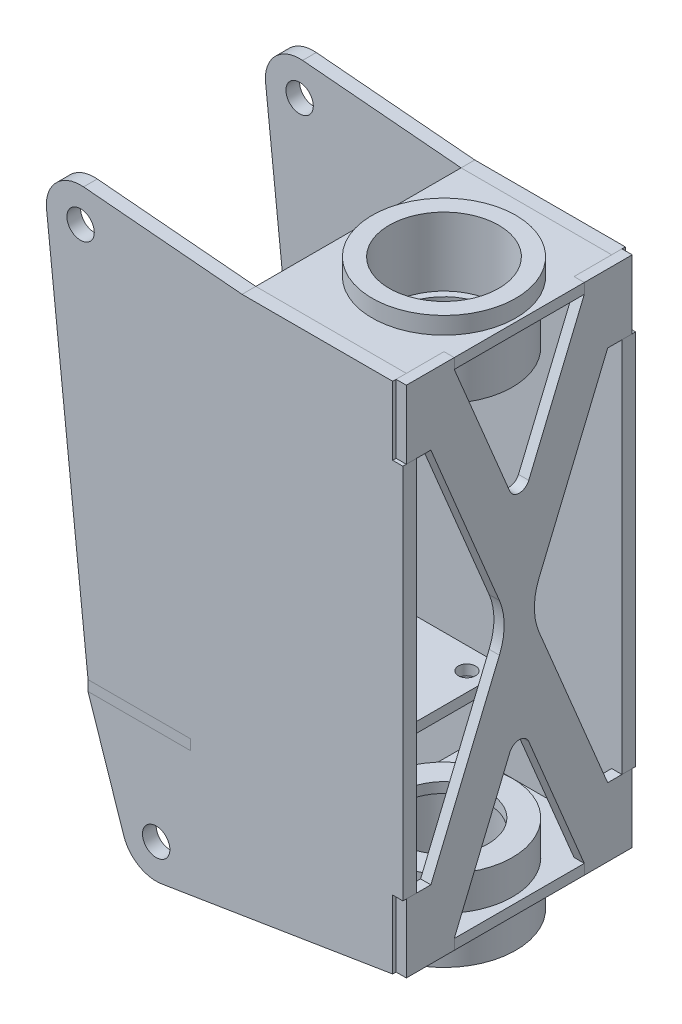
from build123d import *

# Parameters (mm, degrees)
SKETCH5_R            = 20
BOSS_EXTRUDE1_DEPTH  = 3
SKETCH14_R           = 4
BOSS_EXTRUDE7_DEPTH  = 4
BOSS_EXTRUDE11_START = -60
SKETCH14_3_R         = 4
BOSS_EXTRUDE11_DEPTH = 4
SKETCH15_R           = 2.5
SKETCH15_R_2         = 20
BOSS_EXTRUDE12_DEPTH = 3
SKETCH7_R            = 20
BOSS_EXTRUDE3_DEPTH  = 3
BOSS_EXTRUDE6_DEPTH  = 3


with BuildPart() as part:
    # Sketch5 → Boss-Extrude1 (new body)
    with BuildSketch(Plane(origin=(0, 0, 0), x_dir=(1, 0, 0), z_dir=(0, 1, 0))):
        Polygon((-25, -30), (19, -30), (19, -19), (22, -19), (22, 19), (19, 19), (19, 30), (-25, 30), align=None)
        with Locations(Location((0, 0, 0), (0, 0, 270))):
            Circle(SKETCH5_R, mode=Mode.SUBTRACT)
    extrude(amount=-BOSS_EXTRUDE1_DEPTH)


with BuildPart() as body_2:
    # Sketch14 → Boss-Extrude7 (new body)
    with BuildSketch(Plane.XY.offset(30)):
        with BuildLine():
            Line((19, 0), (-25, 0))
            Line((-25, 0), (-71.313981868, 4.034965698))
            ThreePointArc((-71.313981868, 4.034965698), (-79.32327642, 1.072769513), (-82.124846275, -6.994114135))
            Line((-82.124846275, -6.994114135), (-70, -120))
            Line((-70, -120), (-40, -120))
            Line((-40, -120), (-40, -123))
            Line((-40, -123), (-70, -123))
            Line((-70, -123), (-59.580907072, -154.233592173))
            ThreePointArc((-59.580907072, -154.233592173), (-55.270953296, -159.62528708), (-48.494762627, -160.940321502))
            Line((-48.494762627, -160.940321502), (19, -150))
            Line((19, -150), (19, -130))
            Line((19, -130), (22, -130))
            Line((22, -130), (22, -20))
            Line((22, -20), (19, -20))
            Line((19, -20), (19, 0))
        make_face()
        with Locations((-50.094793735, -151.069156401)):
            Circle(SKETCH14_R, mode=Mode.SUBTRACT)
        with Locations((-72.181913966, -5.927297794)):
            Circle(SKETCH14_R, mode=Mode.SUBTRACT)
    extrude(amount=BOSS_EXTRUDE7_DEPTH)


with BuildPart() as body_3:
    # Sketch14<3> → Boss-Extrude11 (new body)
    with BuildSketch(Plane.XY.offset(30).offset(BOSS_EXTRUDE11_START)):
        with BuildLine():
            Line((19, 0), (-25, 0))
            Line((-25, 0), (-71.313981868, 4.034965698))
            ThreePointArc((-71.313981868, 4.034965698), (-79.32327642, 1.072769513), (-82.124846275, -6.994114135))
            Line((-82.124846275, -6.994114135), (-70, -120))
            Line((-70, -120), (-40, -120))
            Line((-40, -120), (-40, -123))
            Line((-40, -123), (-70, -123))
            Line((-70, -123), (-59.580907072, -154.233592173))
            ThreePointArc((-59.580907072, -154.233592173), (-55.270953296, -159.62528708), (-48.494762627, -160.940321502))
            Line((-48.494762627, -160.940321502), (19, -150))
            Line((19, -150), (19, -130))
            Line((19, -130), (22, -130))
            Line((22, -130), (22, -20))
            Line((22, -20), (19, -20))
            Line((19, -20), (19, 0))
        make_face()
        with Locations((-50.094793735, -151.069156401)):
            Circle(SKETCH14_3_R, mode=Mode.SUBTRACT)
        with Locations((-72.181913966, -5.927297794)):
            Circle(SKETCH14_3_R, mode=Mode.SUBTRACT)
    extrude(amount=-BOSS_EXTRUDE11_DEPTH)


with BuildPart() as body_4:
    # Sketch15 → Boss-Extrude12 (new body)
    with BuildSketch(Plane(origin=(0, -120, 0), x_dir=(1, 0, 0), z_dir=(0, 1, 0))):
        Polygon((-11.43, 30), (-11.43, -30), (-40, -30), (-40, -34), (-70, -34), (-70, 34), (-40, 34), (-40, 30), align=None)
        with Locations(Location((-16.86, -23.57, 0), (0, 0, 270))):
            Circle(SKETCH15_R, mode=Mode.SUBTRACT)
        with Locations(Location((-40.43, 0, 0), (0, 0, 270))):
            Circle(SKETCH15_R_2, mode=Mode.SUBTRACT)
        with Locations(Location((-64, -23.57, 0), (0, 0, 270))):
            Circle(SKETCH15_R, mode=Mode.SUBTRACT)
        with Locations(Location((-16.86, 23.57, 0), (0, 0, 270))):
            Circle(SKETCH15_R, mode=Mode.SUBTRACT)
        with Locations(Location((-64, 23.57, 0), (0, 0, 270))):
            Circle(SKETCH15_R, mode=Mode.SUBTRACT)
    extrude(amount=-BOSS_EXTRUDE12_DEPTH)


with BuildPart() as body_5:
    # Sketch7 → Boss-Extrude3 (new body)
    with BuildSketch(Plane(origin=(0, -150, 0), x_dir=(-1, 0, 0), z_dir=(0, 1, 0))):
        Polygon((25, -30), (25, 30), (-19, 30), (-19, 19), (-22, 19), (-22, -19), (-19, -19), (-19, -30), align=None)
        with Locations(Location((0, 0, 0), (0, 0, 90))):
            Circle(SKETCH7_R, mode=Mode.SUBTRACT)
    extrude(amount=BOSS_EXTRUDE3_DEPTH)


with BuildPart() as body_6:
    # Sketch1 → Revolve1 (revolve)
    with BuildSketch(Plane(origin=(0, 0, 0), x_dir=(0, 0, -1), z_dir=(1, 0, 0)), mode=Mode.PRIVATE) as revolve1_sk:
        Polygon((-20, -150), (-20, -137), (-13, -137), (-13, -140), (-16, -140), (-16, -160), (-21, -160), (-21, -150), align=None)
        Polygon((-21, 5), (-21, 0), (-20, 0), (-20, -18), (-14, -18), (-14, -15), (-16, -15), (-16, 5), align=None)
    revolve(revolve1_sk.sketch.rotate(Axis((0, 0, 0), (0, 1, 0)), 180), axis=Axis((0, 0, 0), (0, 1, 0)))


with BuildPart() as body_7:
    # Sketch12 → Boss-Extrude6 (new body)
    with BuildSketch(Plane(origin=(22, 0, 0), x_dir=(0, 0, -1), z_dir=(1, 0, 0))):
        with BuildLine():
            Line((-33, -20), (-33, 0))
            Line((-33, 0), (-19, 0))
            Line((-19, 0), (-19, -3))
            Line((-19, -3), (-2.769230769, -41.953846154))
            ThreePointArc((-2.769230769, -41.953846154), (0, -43.8), (2.769230769, -41.953846154))
            Line((2.769230769, -41.953846154), (19, -3))
            Line((19, -3), (19, 0))
            Line((19, 0), (33, 0))
            Line((33, 0), (33, -20))
            Line((33, -20), (25.833333333, -20))
            Line((25.833333333, -20), (5.801282051, -68.076923077))
            ThreePointArc((5.801282051, -68.076923077), (4.416666667, -75), (5.801282051, -81.923076923))
            Line((5.801282051, -81.923076923), (25.833333333, -130))
            Line((25.833333333, -130), (33, -130))
            Line((33, -130), (33, -150))
            Line((33, -150), (19, -150))
            Line((19, -150), (19, -147))
            Line((19, -147), (2.769230769, -108.046153846))
            ThreePointArc((2.769230769, -108.046153846), (0, -106.2), (-2.769230769, -108.046153846))
            Line((-2.769230769, -108.046153846), (-19, -147))
            Line((-19, -147), (-19, -150))
            Line((-19, -150), (-33, -150))
            Line((-33, -150), (-33, -130))
            Line((-33, -130), (-25.833333333, -130))
            Line((-25.833333333, -130), (-5.801282051, -81.923076923))
            ThreePointArc((-5.801282051, -81.923076923), (-4.416666667, -75), (-5.801282051, -68.076923077))
            Line((-5.801282051, -68.076923077), (-25.833333333, -20))
            Line((-25.833333333, -20), (-33, -20))
        make_face()
    extrude(amount=-BOSS_EXTRUDE6_DEPTH)


solid = Compound([part.part, body_2.part, body_3.part, body_4.part, body_5.part, body_6.part, body_7.part])
